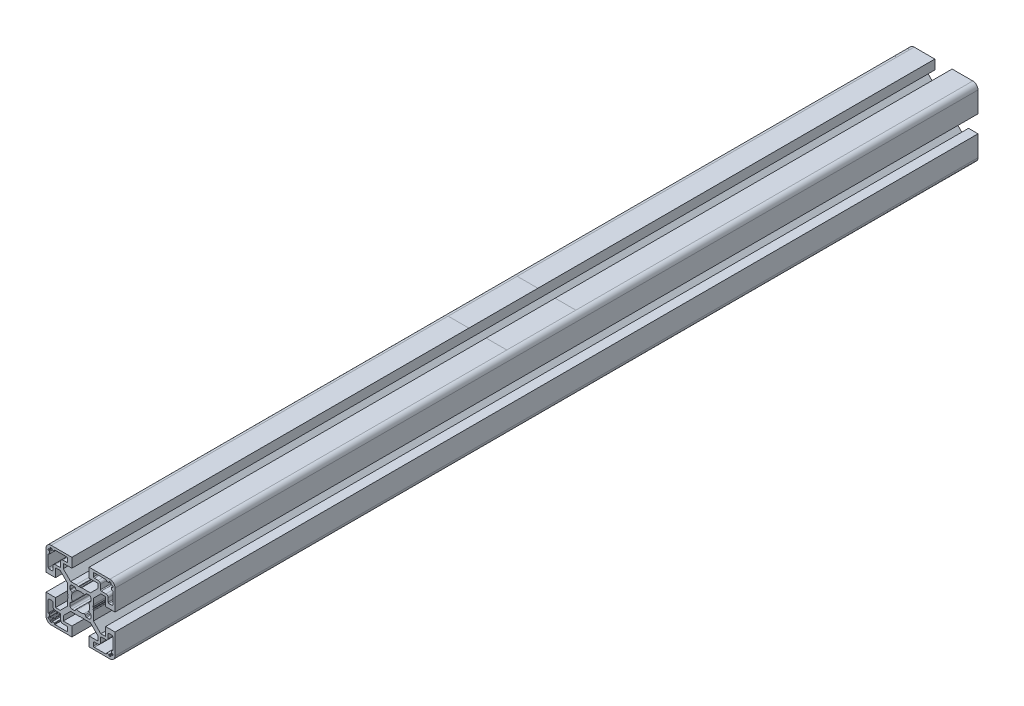
from build123d import *

# Parameters (mm, degrees)
BOSS_EXTRU_1_DEPTH = 500


with BuildPart() as part:
    # Esquisse1 → Boss.-Extru.1 (new body)
    with BuildSketch(Plane.XY.offset(50)):
        with BuildLine():
            Line((-12.564461466, 27.123082583), (-12.564461466, 15.123082583))
            Line((-12.564461466, 15.123082583), (-7.064461466, 15.123082583))
            Line((-7.064461466, 15.123082583), (-7.064461466, 20.123082583))
            Line((-7.064461466, 20.123082583), (-4.332228419, 20.123082583))
            Line((-4.332228419, 20.123082583), (-0.064461466, 15.85531563))
            Line((-0.064461466, 15.85531563), (-0.064461466, 10.776672421))
            ThreePointArc((-0.064461466, 10.776672421), (-0.047424379, 10.647262899), (0.002525832, 10.526672421))
            Line((0.002525832, 10.526672421), (0.235538534, 10.123082583))
            Line((0.235538534, 10.123082583), (0.002525832, 9.719492744))
            ThreePointArc((0.002525832, 9.719492744), (-0.064461466, 9.469492744), (0.002525832, 9.219492744))
            Line((0.002525832, 9.219492744), (0.184561942, 8.904196954))
            Line((0.184561942, 8.904196954), (-0.064461466, 7.623082583))
            Line((-0.064461466, 7.623082583), (-0.064461466, 4.390849536))
            Line((-0.064461466, 4.390849536), (-4.332228419, 0.123082583))
            Line((-4.332228419, 0.123082583), (-7.064461466, 0.123082583))
            Line((-7.064461466, 0.123082583), (-7.064461466, 5.123082583))
            Line((-7.064461466, 5.123082583), (-12.564461466, 5.123082583))
            Line((-12.564461466, 5.123082583), (-12.564461466, -6.876917417))
            ThreePointArc((-12.564461466, -6.876917417), (-11.685781809, -8.998237761), (-9.564461466, -9.876917417))
            Line((-9.564461466, -9.876917417), (2.435538534, -9.876917417))
            Line((2.435538534, -9.876917417), (2.435538534, -4.376917417))
            Line((2.435538534, -4.376917417), (-2.564461466, -4.376917417))
            Line((-2.564461466, -4.376917417), (-2.564461466, -1.64468437))
            Line((-2.564461466, -1.64468437), (1.703305487, 2.623082583))
            Line((1.703305487, 2.623082583), (6.781948696, 2.623082583))
            ThreePointArc((6.781948696, 2.623082583), (6.911358218, 2.640119669), (7.031948696, 2.690069881))
            Line((7.031948696, 2.690069881), (7.435538534, 2.923082583))
            Line((7.435538534, 2.923082583), (7.839128373, 2.690069881))
            ThreePointArc((7.839128373, 2.690069881), (8.089128373, 2.623082583), (8.339128373, 2.690069881))
            Line((8.339128373, 2.690069881), (8.654424163, 2.87210599))
            Line((8.654424163, 2.87210599), (9.935538534, 2.623082583))
            Line((9.935538534, 2.623082583), (13.167771581, 2.623082583))
            Line((13.167771581, 2.623082583), (17.435538534, -1.64468437))
            Line((17.435538534, -1.64468437), (17.435538534, -4.376917417))
            Line((17.435538534, -4.376917417), (12.435538534, -4.376917417))
            Line((12.435538534, -4.376917417), (12.435538534, -9.876917417))
            Line((12.435538534, -9.876917417), (24.435538534, -9.876917417))
            ThreePointArc((24.435538534, -9.876917417), (26.556858878, -8.998237761), (27.435538534, -6.876917417))
            Line((27.435538534, -6.876917417), (27.435538534, 5.123082583))
            Line((27.435538534, 5.123082583), (21.935538534, 5.123082583))
            Line((21.935538534, 5.123082583), (21.935538534, 0.123082583))
            Line((21.935538534, 0.123082583), (19.203305487, 0.123082583))
            Line((19.203305487, 0.123082583), (14.935538534, 4.390849536))
            Line((14.935538534, 4.390849536), (14.935538534, 9.469492744))
            ThreePointArc((14.935538534, 9.469492744), (14.918501447, 9.598902267), (14.868551236, 9.719492744))
            Line((14.868551236, 9.719492744), (14.635538534, 10.123082583))
            Line((14.635538534, 10.123082583), (14.868551236, 10.526672421))
            ThreePointArc((14.868551236, 10.526672421), (14.935538534, 10.776672421), (14.868551236, 11.026672421))
            Line((14.868551236, 11.026672421), (14.686515127, 11.341968211))
            Line((14.686515127, 11.341968211), (14.935538534, 12.623082583))
            Line((14.935538534, 12.623082583), (14.935538534, 15.85531563))
            Line((14.935538534, 15.85531563), (19.203305487, 20.123082583))
            Line((19.203305487, 20.123082583), (21.935538534, 20.123082583))
            Line((21.935538534, 20.123082583), (21.935538534, 15.123082583))
            Line((21.935538534, 15.123082583), (27.435538534, 15.123082583))
            Line((27.435538534, 15.123082583), (27.435538534, 27.123082583))
            ThreePointArc((27.435538534, 27.123082583), (26.556858878, 29.244402926), (24.435538534, 30.123082583))
            Line((24.435538534, 30.123082583), (12.435538534, 30.123082583))
            Line((12.435538534, 30.123082583), (12.435538534, 24.623082583))
            Line((12.435538534, 24.623082583), (17.435538534, 24.623082583))
            Line((17.435538534, 24.623082583), (17.435538534, 21.890849536))
            Line((17.435538534, 21.890849536), (13.167771581, 17.623082583))
            Line((13.167771581, 17.623082583), (8.089128373, 17.623082583))
            ThreePointArc((8.089128373, 17.623082583), (7.95971885, 17.606045496), (7.839128373, 17.556095285))
            Line((7.839128373, 17.556095285), (7.435538534, 17.323082583))
            Line((7.435538534, 17.323082583), (7.031948696, 17.556095285))
            ThreePointArc((7.031948696, 17.556095285), (6.781948696, 17.623082583), (6.531948696, 17.556095285))
            Line((6.531948696, 17.556095285), (6.216652905, 17.374059175))
            Line((6.216652905, 17.374059175), (4.935538534, 17.623082583))
            Line((4.935538534, 17.623082583), (1.703305487, 17.623082583))
            Line((1.703305487, 17.623082583), (-2.564461466, 21.890849536))
            Line((-2.564461466, 21.890849536), (-2.564461466, 24.623082583))
            Line((-2.564461466, 24.623082583), (2.435538534, 24.623082583))
            Line((2.435538534, 24.623082583), (2.435538534, 30.123082583))
            Line((2.435538534, 30.123082583), (-9.564461466, 30.123082583))
            ThreePointArc((-9.564461466, 30.123082583), (-11.685781809, 29.244402926), (-12.564461466, 27.123082583))
        make_face()
        with BuildLine():
            Line((-11.264461466, -4.676917417), (-11.264461466, 2.123082583))
            ThreePointArc((-11.264461466, 2.123082583), (-11.118014856, 2.476635973), (-10.764461466, 2.623082583))
            Line((-10.764461466, 2.623082583), (-9.064461466, 2.623082583))
            ThreePointArc((-9.064461466, 2.623082583), (-8.710908075, 2.476635973), (-8.564461466, 2.123082583))
            Line((-8.564461466, 2.123082583), (-8.564461466, -0.076917417))
            ThreePointArc((-8.564461466, -0.076917417), (-8.183700281, -0.996156233), (-7.264461466, -1.376917417))
            Line((-7.264461466, -1.376917417), (-4.564461466, -1.376917417))
            ThreePointArc((-4.564461466, -1.376917417), (-4.210908075, -1.523364027), (-4.064461466, -1.876917417))
            Line((-4.064461466, -1.876917417), (-4.064461466, -4.576917417))
            ThreePointArc((-4.064461466, -4.576917417), (-3.683700281, -5.496156233), (-2.764461466, -5.876917417))
            Line((-2.764461466, -5.876917417), (-0.564461466, -5.876917417))
            ThreePointArc((-0.564461466, -5.876917417), (-0.210908075, -6.023364027), (-0.064461466, -6.376917417))
            Line((-0.064461466, -6.376917417), (-0.064461466, -8.076917417))
            ThreePointArc((-0.064461466, -8.076917417), (-0.210908075, -8.430470808), (-0.564461466, -8.576917417))
            Line((-0.564461466, -8.576917417), (-7.364461466, -8.576917417))
            ThreePointArc((-7.364461466, -8.576917417), (-7.505882822, -8.518338774), (-7.564461466, -8.376917417))
            Line((-7.564461466, -8.376917417), (-7.564461466, -8.076917417))
            ThreePointArc((-7.564461466, -8.076917417), (-7.62304011, -7.935496061), (-7.764461466, -7.876917417))
            Line((-7.764461466, -7.876917417), (-8.964461466, -7.876917417))
            ThreePointArc((-8.964461466, -7.876917417), (-9.105882822, -7.935496061), (-9.164461466, -8.076917417))
            Line((-9.164461466, -8.076917417), (-9.164461466, -8.376917417))
            ThreePointArc((-9.164461466, -8.376917417), (-9.22304011, -8.518338774), (-9.364461466, -8.576917417))
            Line((-9.364461466, -8.576917417), (-9.864461466, -8.576917417))
            ThreePointArc((-9.864461466, -8.576917417), (-10.0765935, -8.489049452), (-10.164461466, -8.276917417))
            Line((-10.164461466, -8.276917417), (-10.164461466, -7.776917417))
            ThreePointArc((-10.164461466, -7.776917417), (-10.252329431, -7.564785383), (-10.464461466, -7.476917417))
            Line((-10.464461466, -7.476917417), (-10.964461466, -7.476917417))
            ThreePointArc((-10.964461466, -7.476917417), (-11.1765935, -7.389049452), (-11.264461466, -7.176917417))
            Line((-11.264461466, -7.176917417), (-11.264461466, -6.676917417))
            ThreePointArc((-11.264461466, -6.676917417), (-11.205882822, -6.535496061), (-11.064461466, -6.476917417))
            Line((-11.064461466, -6.476917417), (-10.764461466, -6.476917417))
            ThreePointArc((-10.764461466, -6.476917417), (-10.62304011, -6.418338774), (-10.564461466, -6.276917417))
            Line((-10.564461466, -6.276917417), (-10.564461466, -5.076917417))
            ThreePointArc((-10.564461466, -5.076917417), (-10.62304011, -4.935496061), (-10.764461466, -4.876917417))
            Line((-10.764461466, -4.876917417), (-11.064461466, -4.876917417))
            ThreePointArc((-11.064461466, -4.876917417), (-11.205882822, -4.818338774), (-11.264461466, -4.676917417))
        make_face(mode=Mode.SUBTRACT)
        with BuildLine():
            Line((14.935538534, -8.076917417), (14.935538534, -6.376917417))
            ThreePointArc((14.935538534, -6.376917417), (15.081985144, -6.023364027), (15.435538534, -5.876917417))
            Line((15.435538534, -5.876917417), (17.635538534, -5.876917417))
            ThreePointArc((17.635538534, -5.876917417), (18.55477735, -5.496156233), (18.935538534, -4.576917417))
            Line((18.935538534, -4.576917417), (18.935538534, -1.876917417))
            ThreePointArc((18.935538534, -1.876917417), (19.081985144, -1.523364027), (19.435538534, -1.376917417))
            Line((19.435538534, -1.376917417), (22.135538534, -1.376917417))
            ThreePointArc((22.135538534, -1.376917417), (23.05477735, -0.996156233), (23.435538534, -0.076917417))
            Line((23.435538534, -0.076917417), (23.435538534, 2.123082583))
            ThreePointArc((23.435538534, 2.123082583), (23.581985144, 2.476635973), (23.935538534, 2.623082583))
            Line((23.935538534, 2.623082583), (25.635538534, 2.623082583))
            ThreePointArc((25.635538534, 2.623082583), (25.989091925, 2.476635973), (26.135538534, 2.123082583))
            Line((26.135538534, 2.123082583), (26.135538534, -4.676917417))
            ThreePointArc((26.135538534, -4.676917417), (26.07695989, -4.818338774), (25.935538534, -4.876917417))
            Line((25.935538534, -4.876917417), (25.635538534, -4.876917417))
            ThreePointArc((25.635538534, -4.876917417), (25.494117178, -4.935496061), (25.435538534, -5.076917417))
            Line((25.435538534, -5.076917417), (25.435538534, -6.276917417))
            ThreePointArc((25.435538534, -6.276917417), (25.494117178, -6.418338774), (25.635538534, -6.476917417))
            Line((25.635538534, -6.476917417), (25.935538534, -6.476917417))
            ThreePointArc((25.935538534, -6.476917417), (26.07695989, -6.535496061), (26.135538534, -6.676917417))
            Line((26.135538534, -6.676917417), (26.135538534, -7.176917417))
            ThreePointArc((26.135538534, -7.176917417), (26.047670569, -7.389049452), (25.835538534, -7.476917417))
            Line((25.835538534, -7.476917417), (25.335538534, -7.476917417))
            ThreePointArc((25.335538534, -7.476917417), (25.1234065, -7.564785383), (25.035538534, -7.776917417))
            Line((25.035538534, -7.776917417), (25.035538534, -8.276917417))
            ThreePointArc((25.035538534, -8.276917417), (24.947670569, -8.489049452), (24.735538534, -8.576917417))
            Line((24.735538534, -8.576917417), (24.235538534, -8.576917417))
            ThreePointArc((24.235538534, -8.576917417), (24.094117178, -8.518338774), (24.035538534, -8.376917417))
            Line((24.035538534, -8.376917417), (24.035538534, -8.076917417))
            ThreePointArc((24.035538534, -8.076917417), (23.97695989, -7.935496061), (23.835538534, -7.876917417))
            Line((23.835538534, -7.876917417), (22.635538534, -7.876917417))
            ThreePointArc((22.635538534, -7.876917417), (22.494117178, -7.935496061), (22.435538534, -8.076917417))
            Line((22.435538534, -8.076917417), (22.435538534, -8.376917417))
            ThreePointArc((22.435538534, -8.376917417), (22.37695989, -8.518338774), (22.235538534, -8.576917417))
            Line((22.235538534, -8.576917417), (15.435538534, -8.576917417))
            ThreePointArc((15.435538534, -8.576917417), (15.081985144, -8.430470808), (14.935538534, -8.076917417))
        make_face(mode=Mode.SUBTRACT)
        with BuildLine():
            Line((14.935538534, 26.623082583), (14.935538534, 28.323082583))
            ThreePointArc((14.935538534, 28.323082583), (15.081985144, 28.676635973), (15.435538534, 28.823082583))
            Line((15.435538534, 28.823082583), (22.235538534, 28.823082583))
            ThreePointArc((22.235538534, 28.823082583), (22.37695989, 28.764503939), (22.435538534, 28.623082583))
            Line((22.435538534, 28.623082583), (22.435538534, 28.323082583))
            ThreePointArc((22.435538534, 28.323082583), (22.494117178, 28.181661226), (22.635538534, 28.123082583))
            Line((22.635538534, 28.123082583), (23.835538534, 28.123082583))
            ThreePointArc((23.835538534, 28.123082583), (23.97695989, 28.181661226), (24.035538534, 28.323082583))
            Line((24.035538534, 28.323082583), (24.035538534, 28.623082583))
            ThreePointArc((24.035538534, 28.623082583), (24.094117178, 28.764503939), (24.235538534, 28.823082583))
            Line((24.235538534, 28.823082583), (24.735538534, 28.823082583))
            ThreePointArc((24.735538534, 28.823082583), (24.947670569, 28.735214617), (25.035538534, 28.523082583))
            Line((25.035538534, 28.523082583), (25.035538534, 28.023082583))
            ThreePointArc((25.035538534, 28.023082583), (25.1234065, 27.810950548), (25.335538534, 27.723082583))
            Line((25.335538534, 27.723082583), (25.835538534, 27.723082583))
            ThreePointArc((25.835538534, 27.723082583), (26.047670569, 27.635214617), (26.135538534, 27.423082583))
            Line((26.135538534, 27.423082583), (26.135538534, 26.923082583))
            ThreePointArc((26.135538534, 26.923082583), (26.07695989, 26.781661226), (25.935538534, 26.723082583))
            Line((25.935538534, 26.723082583), (25.635538534, 26.723082583))
            ThreePointArc((25.635538534, 26.723082583), (25.494117178, 26.664503939), (25.435538534, 26.523082583))
            Line((25.435538534, 26.523082583), (25.435538534, 25.323082583))
            ThreePointArc((25.435538534, 25.323082583), (25.494117178, 25.181661226), (25.635538534, 25.123082583))
            Line((25.635538534, 25.123082583), (25.935538534, 25.123082583))
            ThreePointArc((25.935538534, 25.123082583), (26.07695989, 25.064503939), (26.135538534, 24.923082583))
            Line((26.135538534, 24.923082583), (26.135538534, 18.123082583))
            ThreePointArc((26.135538534, 18.123082583), (25.989091925, 17.769529192), (25.635538534, 17.623082583))
            Line((25.635538534, 17.623082583), (23.935538534, 17.623082583))
            ThreePointArc((23.935538534, 17.623082583), (23.581985144, 17.769529192), (23.435538534, 18.123082583))
            Line((23.435538534, 18.123082583), (23.435538534, 20.323082583))
            ThreePointArc((23.435538534, 20.323082583), (23.05477735, 21.242321398), (22.135538534, 21.623082583))
            Line((22.135538534, 21.623082583), (19.435538534, 21.623082583))
            ThreePointArc((19.435538534, 21.623082583), (19.081985144, 21.769529192), (18.935538534, 22.123082583))
            Line((18.935538534, 22.123082583), (18.935538534, 24.823082583))
            ThreePointArc((18.935538534, 24.823082583), (18.55477735, 25.742321398), (17.635538534, 26.123082583))
            Line((17.635538534, 26.123082583), (15.435538534, 26.123082583))
            ThreePointArc((15.435538534, 26.123082583), (15.081985144, 26.269529192), (14.935538534, 26.623082583))
        make_face(mode=Mode.SUBTRACT)
        with BuildLine():
            Line((-11.264461466, 18.123082583), (-11.264461466, 24.923082583))
            ThreePointArc((-11.264461466, 24.923082583), (-11.205882822, 25.064503939), (-11.064461466, 25.123082583))
            Line((-11.064461466, 25.123082583), (-10.764461466, 25.123082583))
            ThreePointArc((-10.764461466, 25.123082583), (-10.62304011, 25.181661226), (-10.564461466, 25.323082583))
            Line((-10.564461466, 25.323082583), (-10.564461466, 26.523082583))
            ThreePointArc((-10.564461466, 26.523082583), (-10.62304011, 26.664503939), (-10.764461466, 26.723082583))
            Line((-10.764461466, 26.723082583), (-11.064461466, 26.723082583))
            ThreePointArc((-11.064461466, 26.723082583), (-11.205882822, 26.781661226), (-11.264461466, 26.923082583))
            Line((-11.264461466, 26.923082583), (-11.264461466, 27.423082583))
            ThreePointArc((-11.264461466, 27.423082583), (-11.1765935, 27.635214617), (-10.964461466, 27.723082583))
            Line((-10.964461466, 27.723082583), (-10.464461466, 27.723082583))
            ThreePointArc((-10.464461466, 27.723082583), (-10.252329431, 27.810950548), (-10.164461466, 28.023082583))
            Line((-10.164461466, 28.023082583), (-10.164461466, 28.523082583))
            ThreePointArc((-10.164461466, 28.523082583), (-10.0765935, 28.735214617), (-9.864461466, 28.823082583))
            Line((-9.864461466, 28.823082583), (-9.364461466, 28.823082583))
            ThreePointArc((-9.364461466, 28.823082583), (-9.22304011, 28.764503939), (-9.164461466, 28.623082583))
            Line((-9.164461466, 28.623082583), (-9.164461466, 28.323082583))
            ThreePointArc((-9.164461466, 28.323082583), (-9.105882822, 28.181661226), (-8.964461466, 28.123082583))
            Line((-8.964461466, 28.123082583), (-7.764461466, 28.123082583))
            ThreePointArc((-7.764461466, 28.123082583), (-7.62304011, 28.181661226), (-7.564461466, 28.323082583))
            Line((-7.564461466, 28.323082583), (-7.564461466, 28.623082583))
            ThreePointArc((-7.564461466, 28.623082583), (-7.505882822, 28.764503939), (-7.364461466, 28.823082583))
            Line((-7.364461466, 28.823082583), (-0.564461466, 28.823082583))
            ThreePointArc((-0.564461466, 28.823082583), (-0.210908075, 28.676635973), (-0.064461466, 28.323082583))
            Line((-0.064461466, 28.323082583), (-0.064461466, 26.623082583))
            ThreePointArc((-0.064461466, 26.623082583), (-0.210908075, 26.269529192), (-0.564461466, 26.123082583))
            Line((-0.564461466, 26.123082583), (-2.764461466, 26.123082583))
            ThreePointArc((-2.764461466, 26.123082583), (-3.683700281, 25.742321398), (-4.064461466, 24.823082583))
            Line((-4.064461466, 24.823082583), (-4.064461466, 22.123082583))
            ThreePointArc((-4.064461466, 22.123082583), (-4.210908075, 21.769529192), (-4.564461466, 21.623082583))
            Line((-4.564461466, 21.623082583), (-7.264461466, 21.623082583))
            ThreePointArc((-7.264461466, 21.623082583), (-8.183700281, 21.242321398), (-8.564461466, 20.323082583))
            Line((-8.564461466, 20.323082583), (-8.564461466, 18.123082583))
            ThreePointArc((-8.564461466, 18.123082583), (-8.710908075, 17.769529192), (-9.064461466, 17.623082583))
            Line((-9.064461466, 17.623082583), (-10.764461466, 17.623082583))
            ThreePointArc((-10.764461466, 17.623082583), (-11.118014856, 17.769529192), (-11.264461466, 18.123082583))
        make_face(mode=Mode.SUBTRACT)
        with BuildLine():
            Line((10.926225434, 16.123082583), (12.435538534, 16.123082583))
            ThreePointArc((12.435538534, 16.123082583), (13.142645315, 15.830189364), (13.435538534, 15.123082583))
            Line((13.435538534, 15.123082583), (13.435538534, 13.613769482))
            ThreePointArc((13.435538534, 13.613769482), (13.364122185, 13.356250445), (13.170274316, 13.172295686))
            Line((13.170274316, 13.172295686), (12.493256258, 12.812318799))
            ThreePointArc((12.493256258, 12.812318799), (12.256654607, 12.537701304), (12.267778691, 12.175387401))
            ThreePointArc((12.267778691, 12.175387401), (12.685538534, 10.123082583), (12.267778691, 8.070777764))
            ThreePointArc((12.267778691, 8.070777764), (12.256654607, 7.708463861), (12.493256258, 7.433846366))
            Line((12.493256258, 7.433846366), (13.170274316, 7.07386948))
            ThreePointArc((13.170274316, 7.07386948), (13.364122185, 6.889914721), (13.435538534, 6.632395683))
            Line((13.435538534, 6.632395683), (13.435538534, 5.123082583))
            ThreePointArc((13.435538534, 5.123082583), (13.142645315, 4.415975801), (12.435538534, 4.123082583))
            Line((12.435538534, 4.123082583), (10.926225434, 4.123082583))
            ThreePointArc((10.926225434, 4.123082583), (10.668706396, 4.194498932), (10.484751637, 4.388346801))
            Line((10.484751637, 4.388346801), (10.124774751, 5.065364859))
            ThreePointArc((10.124774751, 5.065364859), (9.850157255, 5.301966509), (9.487843352, 5.290842426))
            ThreePointArc((9.487843352, 5.290842426), (7.435538534, 4.873082583), (5.383233716, 5.290842426))
            ThreePointArc((5.383233716, 5.290842426), (5.020919813, 5.301966509), (4.746302318, 5.065364859))
            Line((4.746302318, 5.065364859), (4.386325431, 4.388346801))
            ThreePointArc((4.386325431, 4.388346801), (4.202370672, 4.194498932), (3.944851635, 4.123082583))
            Line((3.944851635, 4.123082583), (2.435538534, 4.123082583))
            ThreePointArc((2.435538534, 4.123082583), (1.728431753, 4.415975801), (1.435538534, 5.123082583))
            Line((1.435538534, 5.123082583), (1.435538534, 6.632395683))
            ThreePointArc((1.435538534, 6.632395683), (1.506954884, 6.889914721), (1.700802753, 7.07386948))
            Line((1.700802753, 7.07386948), (2.37782081, 7.433846366))
            ThreePointArc((2.37782081, 7.433846366), (2.614422461, 7.708463861), (2.603298377, 8.070777764))
            ThreePointArc((2.603298377, 8.070777764), (2.185538534, 10.123082583), (2.603298377, 12.175387401))
            ThreePointArc((2.603298377, 12.175387401), (2.614422461, 12.537701304), (2.37782081, 12.812318799))
            Line((2.37782081, 12.812318799), (1.700802753, 13.172295686))
            ThreePointArc((1.700802753, 13.172295686), (1.506954884, 13.356250445), (1.435538534, 13.613769482))
            Line((1.435538534, 13.613769482), (1.435538534, 15.123082583))
            ThreePointArc((1.435538534, 15.123082583), (1.728431753, 15.830189364), (2.435538534, 16.123082583))
            Line((2.435538534, 16.123082583), (3.944851635, 16.123082583))
            ThreePointArc((3.944851635, 16.123082583), (4.202370672, 16.051666233), (4.386325431, 15.857818364))
            Line((4.386325431, 15.857818364), (4.746302318, 15.180800306))
            ThreePointArc((4.746302318, 15.180800306), (5.020919813, 14.944198656), (5.383233716, 14.955322739))
            ThreePointArc((5.383233716, 14.955322739), (7.435538534, 15.373082583), (9.487843352, 14.955322739))
            ThreePointArc((9.487843352, 14.955322739), (9.850157255, 14.944198656), (10.124774751, 15.180800306))
            Line((10.124774751, 15.180800306), (10.484751637, 15.857818364))
            ThreePointArc((10.484751637, 15.857818364), (10.668706396, 16.051666233), (10.926225434, 16.123082583))
        make_face(mode=Mode.SUBTRACT)
    extrude(amount=-BOSS_EXTRU_1_DEPTH)


solid = part.part
